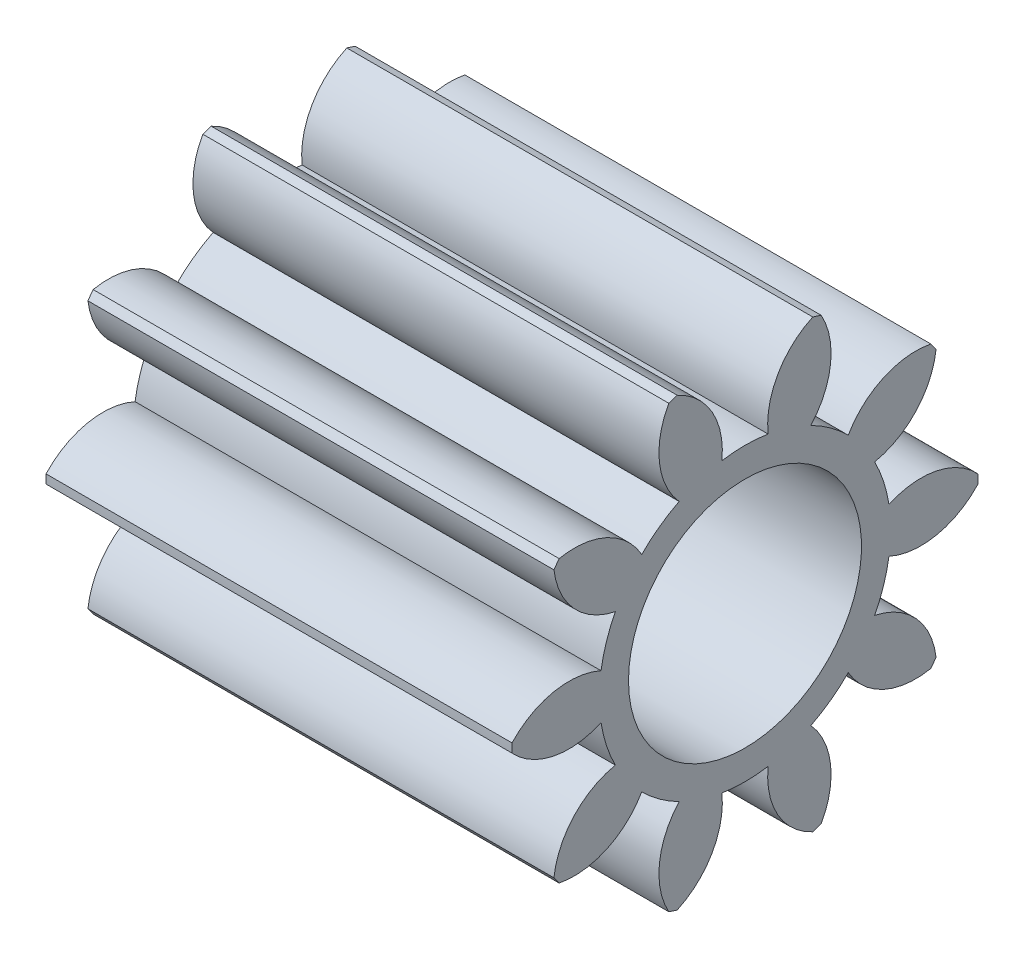
from build123d import *

# Parameters (mm, degrees)
BASPROSKE_W     = 12.7
BASPROSKE_H     = 6.35
TOOTHCUT_DEPTH  = 16.554259867
TEETHCUTS_COUNT = 10
TEETHCUTS_ANGLE = 324
BORSKE_R        = 3.175
BORE_DEPTH      = 50.8000508


with BuildPart() as part:
    # BasProSke → Base-Revolve (revolve)
    with BuildSketch(Plane(origin=(0, 0, 0), x_dir=(1, 0, 0), z_dir=(0, 1, 0)), mode=Mode.PRIVATE) as base_revolve_sk:
        with Locations((6.35, 3.175)):
            Rectangle(BASPROSKE_W, BASPROSKE_H)
    revolve(base_revolve_sk.sketch.rotate(Axis((-10, 0, 0), (1, 0, 0)), 180), axis=Axis((-10, 0, 0), (1, 0, 0)))

    # TooCutSke → ToothCut (cut, through all)
    with BuildSketch(Plane(origin=(0, 0, 0), x_dir=(0, 0, -1), z_dir=(1, 0, 0))):
        with BuildLine():
            ThreePointArc((0.630210727, 3.920537785), (0, 3.970866667), (-0.630210727, 3.920537785))
            ThreePointArc((-0.630210727, 3.920537785), (-0.900510691, 5.2110639), (-1.88228345, 6.091201374))
            ThreePointArc((-1.88228345, 6.091201374), (0, 6.3754), (1.88228345, 6.091201374))
            ThreePointArc((1.88228345, 6.091201374), (0.900510691, 5.2110639), (0.630210727, 3.920537785))
        make_face()
    toothcut = extrude(amount=TOOTHCUT_DEPTH, mode=Mode.SUBTRACT)

    # TeethCuts: ToothCut ×10 about axis
    teethcuts_axis = Axis((-10, 0, 0), (1, 0, 0))
    for i in range(1, TEETHCUTS_COUNT):
        add(toothcut.rotate(teethcuts_axis, i * TEETHCUTS_ANGLE / (TEETHCUTS_COUNT - 1)), mode=Mode.SUBTRACT)

    # BorSke → Bore (cut, symmetric)
    with BuildSketch(Plane(origin=(0, 0, 0), x_dir=(0, 0, -1), z_dir=(1, 0, 0))):
        with Locations(Location((0, 0, 0), (0, 0, 180))):
            Circle(BORSKE_R)
    extrude(amount=BORE_DEPTH, both=True, mode=Mode.SUBTRACT)


solid = part.part
